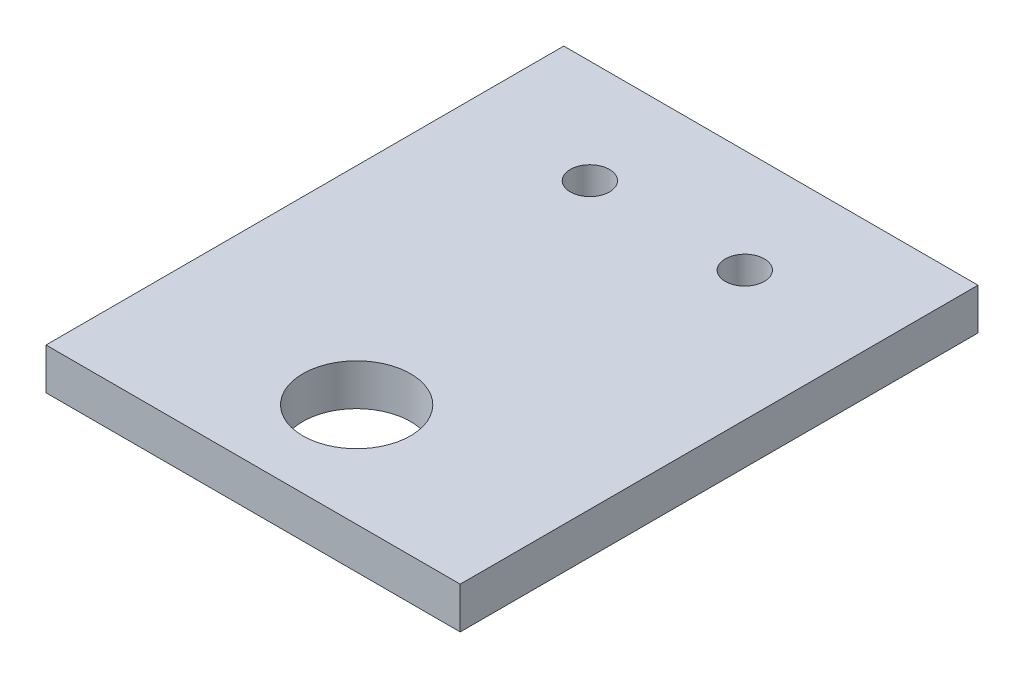
from build123d import *

# Parameters (mm, degrees)
SKETCH2_W                  = 25.4
SKETCH2_H                  = 31.75
BOSS_EXTRUDE1_DEPTH        = 2.54
F_2_4_2_4_DIAMETER_SLOT2_D = 2.4
SKETCH10_R                 = 3.302
CUT_EXTRUDE1_DEPTH         = 3.175


with BuildPart() as part:
    # Sketch2 → Boss-Extrude1 (new body)
    with BuildSketch(Plane(origin=(0, 0, 0), x_dir=(1, 0, 0), z_dir=(0, 1, 0))):
        with Locations((5.805714286, -8.708571429)):
            Rectangle(SKETCH2_W, SKETCH2_H)
    extrude(amount=BOSS_EXTRUDE1_DEPTH)

    # Ø2.4 (2.4) Diameter Slot2 (through all)
    with Locations(Plane(origin=(0, 2.54, 0), x_dir=(1, 0, 0), z_dir=(0, 1, 0))):
        with Locations((1.055714286, 0.816428571), (10.555714286, 0.816428571)):
            Hole(F_2_4_2_4_DIAMETER_SLOT2_D / 2)

    # Sketch10 → Cut-Extrude1 (cut)
    with BuildSketch(Plane(origin=(0, 2.54, 0), x_dir=(1, 0, 0), z_dir=(0, 1, 0))):
        with Locations(Location((5.805714286, -18.233571429, 0), (0, 0, 270))):
            Circle(SKETCH10_R)
    extrude(amount=-CUT_EXTRUDE1_DEPTH, mode=Mode.SUBTRACT)


solid = part.part
